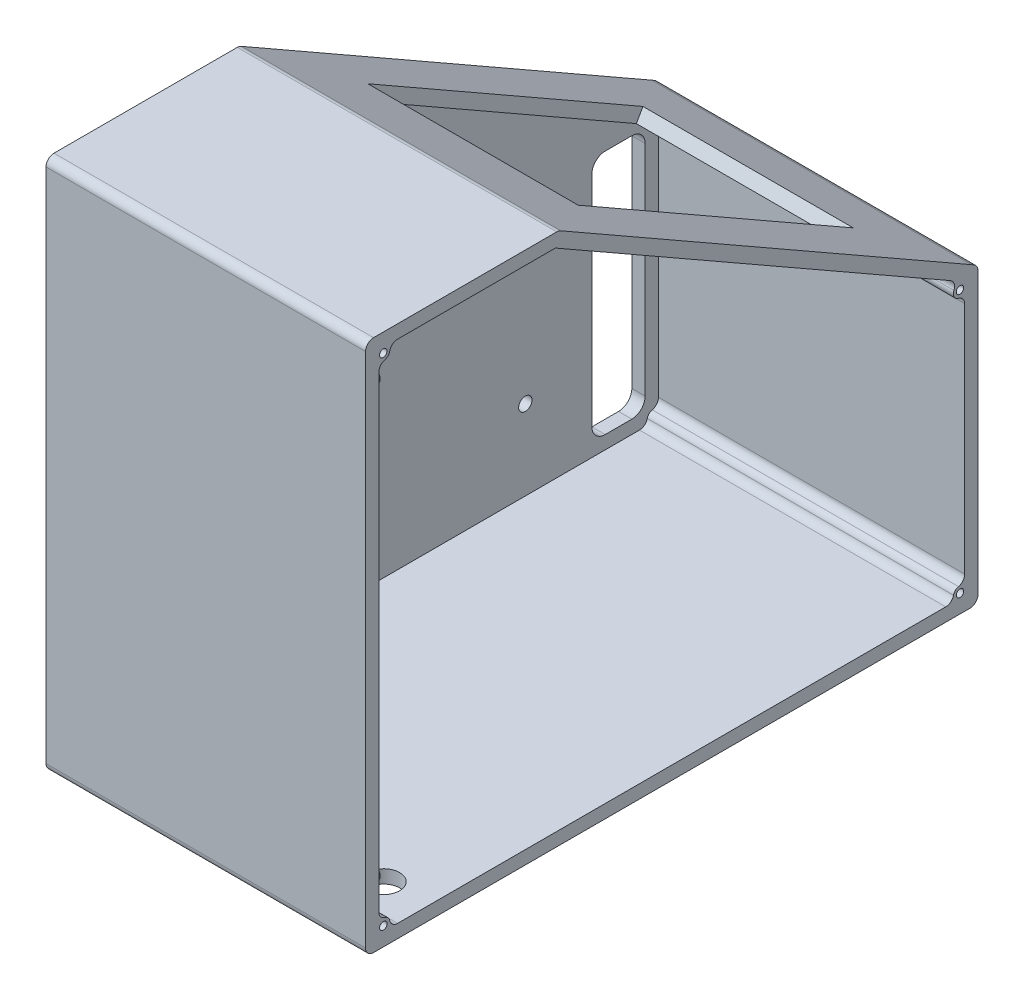
from build123d import *

# Parameters (mm, degrees)
BOSS_EXTRUDE1_DEPTH = 120
CUT_EXTRUDE1_DEPTH  = 115
CUT_EXTRUDE2_DEPTH  = 115
FILLET1_R           = 3
SKETCH4_R           = 2.5
SKETCH4_R_2         = 1.4
BOSS_EXTRUDE2_DEPTH = 115
SKETCH4_2_R         = 1.4
BOSS_EXTRUDE3_DEPTH = 105
FILLET2_R           = 3
SKETCH6_W           = 79
SKETCH6_H           = 119
CUT_EXTRUDE3_DEPTH  = 108
SKETCH9_R           = 2.5
CUT_EXTRUDE4_DEPTH  = 5
SKETCH10_R          = 2.5
SKETCH10_R_2        = 1.4
SKETCH10_W          = 101
SKETCH10_H          = 13.065960553
BOSS_EXTRUDE4_DEPTH = 5
SKETCH11_R          = 5.95
CUT_EXTRUDE5_DEPTH  = 5


with BuildPart() as part:
    # Sketch1 → Boss-Extrude1 (new body)
    with BuildSketch(Plane(origin=(0, 0, 0), x_dir=(0, 0, -1), z_dir=(1, 0, 0))):
        Polygon((-116.603888453, 100.200486057), (-43.990139996, 100.200486057), (110.878369353, 11.707491976), (113.396111547, 10.267579217), (113.396111547, -99.799513943), (-116.603888453, -99.799513943), align=None)
    extrude(amount=BOSS_EXTRUDE1_DEPTH)

    # Sketch2 → Cut-Extrude1 (cut)
    with BuildSketch(Plane(origin=(120, 0, 0), x_dir=(0, 0, -1), z_dir=(1, 0, 0))):
        Polygon((-111.603888453, 95.200486057), (-111.603888453, -94.799513943), (108.396111547, -94.799513943), (108.396111547, 7.367169644), (-45.31791923, 95.200486057), align=None)
    extrude(amount=-CUT_EXTRUDE1_DEPTH, mode=Mode.SUBTRACT)

    # Sketch3 → Cut-Extrude2 (cut)
    with BuildSketch(Plane(origin=(5, 0, 0), x_dir=(0, 0, -1), z_dir=(1, 0, 0))):
        with BuildLine():
            Line((98.396111547, 2.367169644), (88.396111547, 2.367169644))
            ThreePointArc((88.396111547, 2.367169644), (84.860577641, 0.90270355), (83.396111547, -2.632830356))
            Line((83.396111547, -2.632830356), (83.396111547, -84.799513943))
            ThreePointArc((83.396111547, -84.799513943), (84.860577641, -88.335047849), (88.396111547, -89.799513943))
            Line((88.396111547, -89.799513943), (98.396111547, -89.799513943))
            ThreePointArc((98.396111547, -89.799513943), (101.931645453, -88.335047849), (103.396111547, -84.799513943))
            Line((103.396111547, -84.799513943), (103.396111547, -2.632830356))
            ThreePointArc((103.396111547, -2.632830356), (101.931645453, 0.90270355), (98.396111547, 2.367169644))
        make_face()
    extrude(amount=-CUT_EXTRUDE2_DEPTH, mode=Mode.SUBTRACT)

    # Fillet1
    fillet1_edges = [part.edges().sort_by_distance(p)[0] for p in [
        (60, 100.200486057, 43.990139996),
        (60, 10.267579217, -113.396111547),
        (60, -99.799513943, -113.396111547),
        (60, -99.799513943, 116.603888453),
        (60, 100.200486057, 116.603888453),
    ]]
    fillet(fillet1_edges, radius=FILLET1_R)

    # Sketch4 → Boss-Extrude2 (add)
    # profile 1 of 4: a face of its own
    with BuildSketch(Plane(origin=(5, 0, 0), x_dir=(0, 0, -1), z_dir=(1, 0, 0))):
        with Locations((-109.952616945, 93.323439865)):
            Circle(SKETCH4_R)
        with Locations((-109.952616945, 93.323439865)):
            Circle(SKETCH4_R_2, mode=Mode.SUBTRACT)
    # profile 2 of 4: a face of its own
    with BuildSketch(Plane(origin=(5, 0, 0), x_dir=(0, 0, -1), z_dir=(1, 0, 0))):
        with Locations((-109.929256426, -92.943279159)):
            Circle(SKETCH4_R)
        with Locations((-109.929256426, -92.943279159)):
            Circle(SKETCH4_R_2, mode=Mode.SUBTRACT)
    # profile 3 of 4: a face of its own
    with BuildSketch(Plane(origin=(5, 0, 0), x_dir=(0, 0, -1), z_dir=(1, 0, 0))):
        with Locations((106.628344594, -93.03174699)):
            Circle(SKETCH4_R)
        with Locations((106.628344594, -93.03174699)):
            Circle(SKETCH4_R_2, mode=Mode.SUBTRACT)
    # profile 4 of 4: a face of its own
    with BuildSketch(Plane(origin=(5, 0, 0), x_dir=(0, 0, -1), z_dir=(1, 0, 0))):
        with Locations((106.628344594, 5.599402691)):
            Circle(SKETCH4_R)
        with Locations((106.628344594, 5.599402691)):
            Circle(SKETCH4_R_2, mode=Mode.SUBTRACT)
    extrude(amount=BOSS_EXTRUDE2_DEPTH)

    # Sketch4<2> → Boss-Extrude3 (add)
    with BuildSketch(Plane(origin=(5, 0, 0), x_dir=(0, 0, -1), z_dir=(1, 0, 0))):
        with Locations((-109.952616945, 93.323439865)):
            Circle(SKETCH4_2_R)
        with Locations((-109.929256426, -92.943279159)):
            Circle(SKETCH4_2_R)
        with Locations((106.628344594, -93.03174699)):
            Circle(SKETCH4_2_R)
        with Locations((106.628344594, 5.599402691)):
            Circle(SKETCH4_2_R)
    extrude(amount=BOSS_EXTRUDE3_DEPTH)

    # Fillet2
    fillet2_edges = [part.edges().sort_by_distance(p)[0] for p in [
        (62.5, 3.831635738, -108.396111547),
        (62.5, 8.019903673, -107.253784435),
        (62.5, -91.263980037, -108.396111547),
        (62.5, -94.799513943, -104.860577641),
        (62.5, -91.087044375, 111.603888453),
        (62.5, -94.799513943, 108.254624399),
        (62.5, 91.446393673, 111.603888453),
        (62.5, 95.200486057, 108.301345436),
    ]]
    fillet(fillet2_edges, radius=FILLET2_R)

    # Sketch6 → Cut-Extrude3 (cut)
    with BuildSketch(Plane(origin=(0, 56.587896107, -32.33473594), x_dir=(1, 0, 0), z_dir=(0, 0.8682511043894195, -0.49612500413358857))):
        with Locations((60, 3.555675669)):
            Rectangle(SKETCH6_W, SKETCH6_H)
    extrude(amount=-CUT_EXTRUDE3_DEPTH, mode=Mode.SUBTRACT)

    # Sketch9 → Cut-Extrude4 (cut)
    with BuildSketch(Plane(origin=(5, 0, 0), x_dir=(0, 0, -1), z_dir=(1, 0, 0))):
        with Locations((58.396111547, 1.385317381)):
            Circle(SKETCH9_R)
        with Locations((58.396111547, -64.799513943)):
            Circle(SKETCH9_R)
        with Locations((-81.603888453, 65.200486057)):
            Circle(SKETCH9_R)
        with Locations((-81.603888453, -64.799513943)):
            Circle(SKETCH9_R)
    extrude(amount=-CUT_EXTRUDE4_DEPTH, mode=Mode.SUBTRACT)

    # Sketch10 → Boss-Extrude4 (add)
    # profile 1 of 5: a face of its own
    with BuildSketch(Plane(origin=(0, 0, 111.603888453), x_dir=(-1, 0, 0), z_dir=(0, 0, -1))):
        with Locations((-113, 80.991373525)):
            Circle(SKETCH10_R)
        with Locations((-113, 80.991373525)):
            Circle(SKETCH10_R_2, mode=Mode.SUBTRACT)
    # profile 2 of 5: a face of its own
    with BuildSketch(Plane(origin=(0, 0, 111.603888453), x_dir=(-1, 0, 0), z_dir=(0, 0, -1))):
        with Locations((-12, 80.991373525)):
            Circle(SKETCH10_R)
        with Locations((-12, 80.991373525)):
            Circle(SKETCH10_R_2, mode=Mode.SUBTRACT)
    # profile 3 of 5: a face of its own
    with BuildSketch(Plane(origin=(0, 0, 111.603888453), x_dir=(-1, 0, 0), z_dir=(0, 0, -1))):
        with Locations((-62.5, -1.381734535)):
            Rectangle(SKETCH10_W, SKETCH10_H)
    # profile 4 of 5: a face of its own
    with BuildSketch(Plane(origin=(0, 0, 111.603888453), x_dir=(-1, 0, 0), z_dir=(0, 0, -1))):
        with Locations((-113, -80.60535824)):
            Circle(SKETCH10_R)
        with Locations((-113, -80.60535824)):
            Circle(SKETCH10_R_2, mode=Mode.SUBTRACT)
    # profile 5 of 5: a face of its own
    with BuildSketch(Plane(origin=(0, 0, 111.603888453), x_dir=(-1, 0, 0), z_dir=(0, 0, -1))):
        with Locations((-12, -80.60535824)):
            Circle(SKETCH10_R)
        with Locations((-12, -80.60535824)):
            Circle(SKETCH10_R_2, mode=Mode.SUBTRACT)
    extrude(amount=BOSS_EXTRUDE4_DEPTH)

    # Sketch11 → Cut-Extrude5 (cut)
    with BuildSketch(Plane.XZ.offset(99.799513943)):
        with Locations((103.843899656, 93.603888453)):
            Circle(SKETCH11_R)
        with Locations((78.545107218, 93.603888453)):
            Circle(SKETCH11_R)
    extrude(amount=-CUT_EXTRUDE5_DEPTH, mode=Mode.SUBTRACT)


solid = part.part
